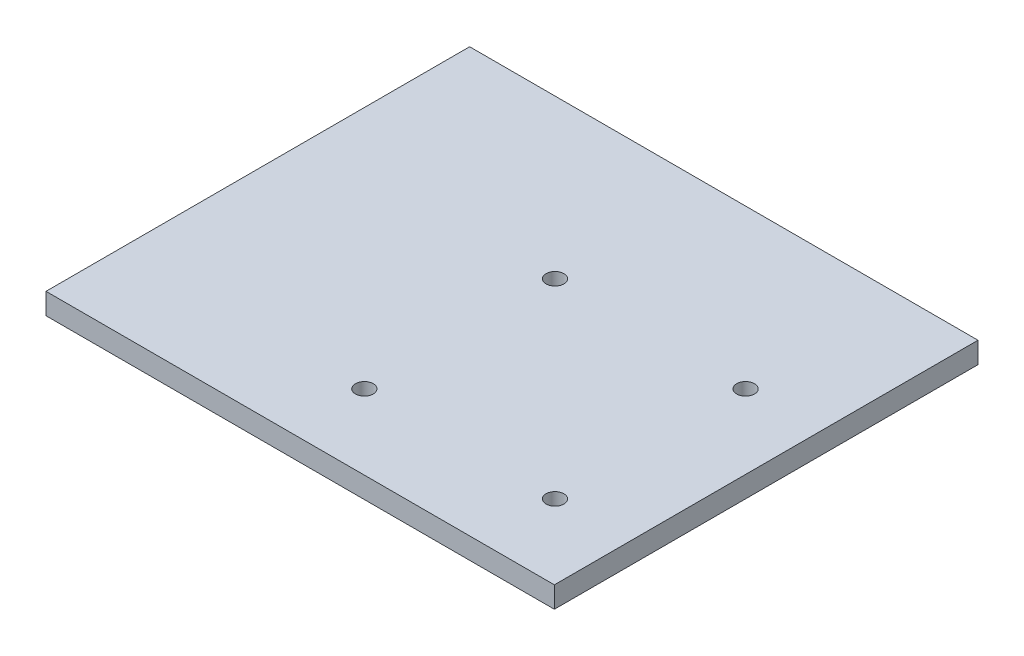
from build123d import *

# Parameters (mm, degrees)
SKETCH1_W               = 304.8
SKETCH1_H               = 254
BOSS_EXTRUDE1_DEPTH     = 12.7
F_1_2_13_TAPPED_HOLE1_D = 10.71626


with BuildPart() as part:
    # Sketch1 → Boss-Extrude1 (new body)
    with BuildSketch(Plane(origin=(0, 0, 0), x_dir=(1, 0, 0), z_dir=(0, 1, 0))):
        Rectangle(SKETCH1_W, SKETCH1_H)
    extrude(amount=BOSS_EXTRUDE1_DEPTH)

    # 1/2-13 Tapped Hole1 (through all)
    with Locations(Plane(origin=(0, 12.7, 0), x_dir=(1, 0, 0), z_dir=(0, 1, 0))):
        with Locations((-6.325164518, 32.09524282), (107.974835482, 32.09524282), (107.974835482, -82.20475718), (-6.325164518, -82.20475718)):
            Hole(F_1_2_13_TAPPED_HOLE1_D / 2)


solid = part.part
